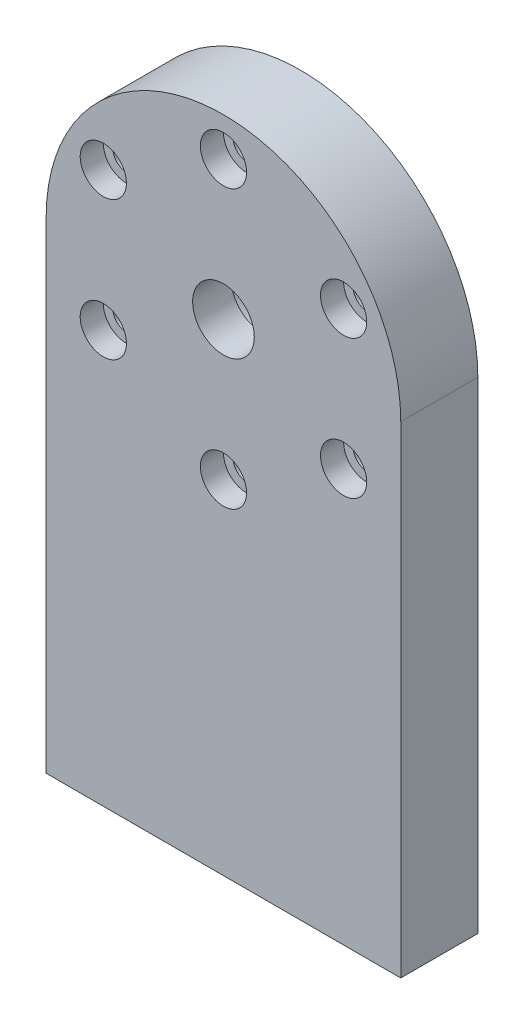
from build123d import *

# Parameters (mm, degrees)
SKETCH1_R                               = 8
BOSS_EXTRUDE1_DEPTH                     = 10
SKETCH3_R                               = 3.5
CUT_EXTRUDE2_DEPTH                      = 179.204938203
SKETCH4_R                               = 6
CUT_EXTRUDE3_DEPTH                      = 6
CIRPATTERN4_COUNT                       = 6
TAP_DRILL_FOR_M10X1_25_TAP1_D           = 8.8
TAP_DRILL_FOR_M10X1_25_TAP1_DEPTH       = 24
TAP_DRILL_FOR_M10X1_25_TAP1_CSINK_D     = 8.85
TAP_DRILL_FOR_M10X1_25_TAP1_CSINK_ANGLE = 90
TAP_DRILL_FOR_M10X1_25_TAP1_TIP         = 2.643786724
SKETCH10_R                              = 12.5
CUT_EXTRUDE4_DEPTH                      = 10


with BuildPart() as part:
    # Sketch1 → Boss-Extrude1 (new, symmetric)
    with BuildSketch(Plane.XY):
        with BuildLine():
            Line((46, 125), (46, 0))
            Line((46, 0), (-46, 0))
            Line((-46, 0), (-46, 125))
            ThreePointArc((-46, 125), (0, 171), (46, 125))
        make_face()
        with Locations((0, 125)):
            Circle(SKETCH1_R, mode=Mode.SUBTRACT)
    extrude(amount=BOSS_EXTRUDE1_DEPTH, both=True)

    # Sketch3 → Cut-Extrude2 (cut, through all)
    with BuildSketch(Plane.XY.offset(10)):
        with Locations((0, 161)):
            Circle(SKETCH3_R)
    cut_extrude2 = extrude(amount=-CUT_EXTRUDE2_DEPTH, mode=Mode.SUBTRACT)

    # Sketch4 → Cut-Extrude3 (cut)
    with BuildSketch(Plane.XY.offset(10)):
        with Locations((0, 161)):
            Circle(SKETCH4_R)
    cut_extrude3 = extrude(amount=-CUT_EXTRUDE3_DEPTH, mode=Mode.SUBTRACT)

    # CirPattern4: Cut-Extrude2, Cut-Extrude3 ×6 about axis
    cirpattern4_axis = Axis((0, 125, 0), (0, 0, 1))
    add([cut_extrude2.rotate(cirpattern4_axis, i * 360 / CIRPATTERN4_COUNT) for i in range(1, CIRPATTERN4_COUNT)], mode=Mode.SUBTRACT)
    add([cut_extrude3.rotate(cirpattern4_axis, i * 360 / CIRPATTERN4_COUNT) for i in range(1, CIRPATTERN4_COUNT)], mode=Mode.SUBTRACT)

    # Tap Drill for M10x1.25 Tap1
    with Locations(Plane(origin=(0, 0, 0), x_dir=(-1, 0, 0), z_dir=(0, -1, 0))):
        with Locations((-30, 0), (30, 0)):
            CounterSinkHole(TAP_DRILL_FOR_M10X1_25_TAP1_D / 2, TAP_DRILL_FOR_M10X1_25_TAP1_CSINK_D / 2, depth=TAP_DRILL_FOR_M10X1_25_TAP1_DEPTH, counter_sink_angle=TAP_DRILL_FOR_M10X1_25_TAP1_CSINK_ANGLE)
            with Locations((0, 0, -(TAP_DRILL_FOR_M10X1_25_TAP1_DEPTH + TAP_DRILL_FOR_M10X1_25_TAP1_TIP / 2))):  # 118° drill point
                Cone(0, TAP_DRILL_FOR_M10X1_25_TAP1_D / 2, TAP_DRILL_FOR_M10X1_25_TAP1_TIP, mode=Mode.SUBTRACT)

    # Sketch10 → Cut-Extrude4 (cut)
    with BuildSketch(Plane(origin=(0, 0, -10), x_dir=(-1, 0, 0), z_dir=(0, 0, -1))):
        with Locations((0, 125)):
            Circle(SKETCH10_R)
    extrude(amount=-CUT_EXTRUDE4_DEPTH, mode=Mode.SUBTRACT)


solid = part.part
